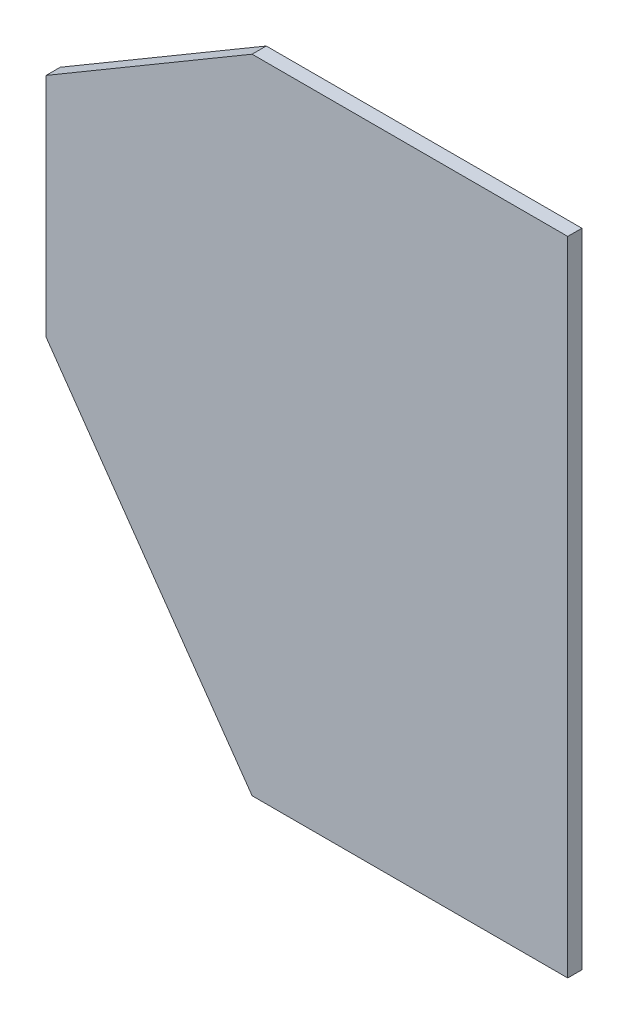
from build123d import *

# Parameters (mm, degrees)
BOSS_EXTRUDE1_DEPTH = 9.525


with BuildPart() as part:
    # Sketch1 → Boss-Extrude1 (new body)
    with BuildSketch(Plane.XY):
        Polygon((-4.280950931, -202.352818846), (-216.488062196, -202.352818846), (-354.995654443, -4.562065129), (-354.995654443, 147.837934871), (-216.488062196, 229.447181154), (-4.280950931, 229.447181154), align=None)
    extrude(amount=BOSS_EXTRUDE1_DEPTH)


solid = part.part
